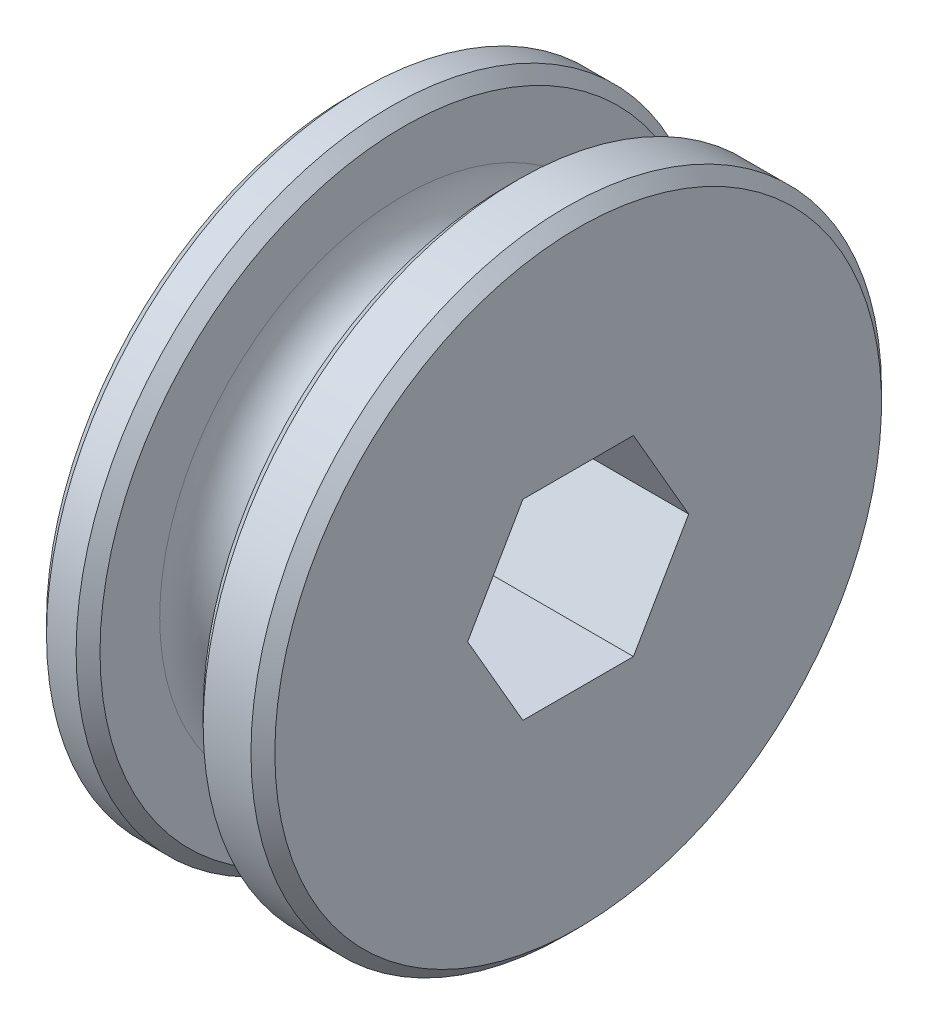
from build123d import *

# Parameters (mm, degrees)
CHAMFER1_SIZE      = 0.79375
CUT_EXTRUDE1_DEPTH = 34.294897541
CHAMFER2_SIZE      = 0.79375


with BuildPart() as part:
    # Sketch1 → Revolve1 (revolve)
    with BuildSketch(Plane.XY, mode=Mode.PRIVATE) as revolve1_sk:
        with BuildLine():
            Line((0, 0), (15.1765, 0))
            Line((15.1765, 0), (15.1765, 20.955))
            Line((15.1765, 20.955), (10.414, 20.955))
            Line((10.414, 20.955), (10.414, 16.1925))
            ThreePointArc((10.414, 16.1925), (6.985, 12.7635), (3.556, 16.1925))
            Line((3.556, 16.1925), (3.556, 20.955))
            Line((3.556, 20.955), (0, 20.955))
            Line((0, 20.955), (0, 0))
        make_face()
    revolve(revolve1_sk.sketch.rotate(Axis((0, 0, 0), (1, 0, 0)), 90), axis=Axis((0, 0, 0), (1, 0, 0)))

    # Chamfer1
    chamfer1_edges = [part.edges().sort_by_distance(p)[0] for p in [
        (0, 0, -20.955),
    ]]
    chamfer(chamfer1_edges, length=CHAMFER1_SIZE)

    # Sketch2 → Cut-Extrude1 (cut, through all)
    with BuildSketch(Plane.ZY):
        Polygon((3.673506558, -6.3627), (7.347013116, 0), (3.673506558, 6.3627), (-3.673506558, 6.3627), (-7.347013116, 0), (-3.673506558, -6.3627), align=None)
    extrude(amount=-CUT_EXTRUDE1_DEPTH, mode=Mode.SUBTRACT)

    # Chamfer2
    chamfer2_edges = [part.edges().sort_by_distance(p)[0] for p in [
        (3.556, 0, -20.955),
        (10.414, 0, -20.955),
        (15.1765, 0, -20.955),
    ]]
    chamfer(chamfer2_edges, length=CHAMFER2_SIZE)


solid = part.part
